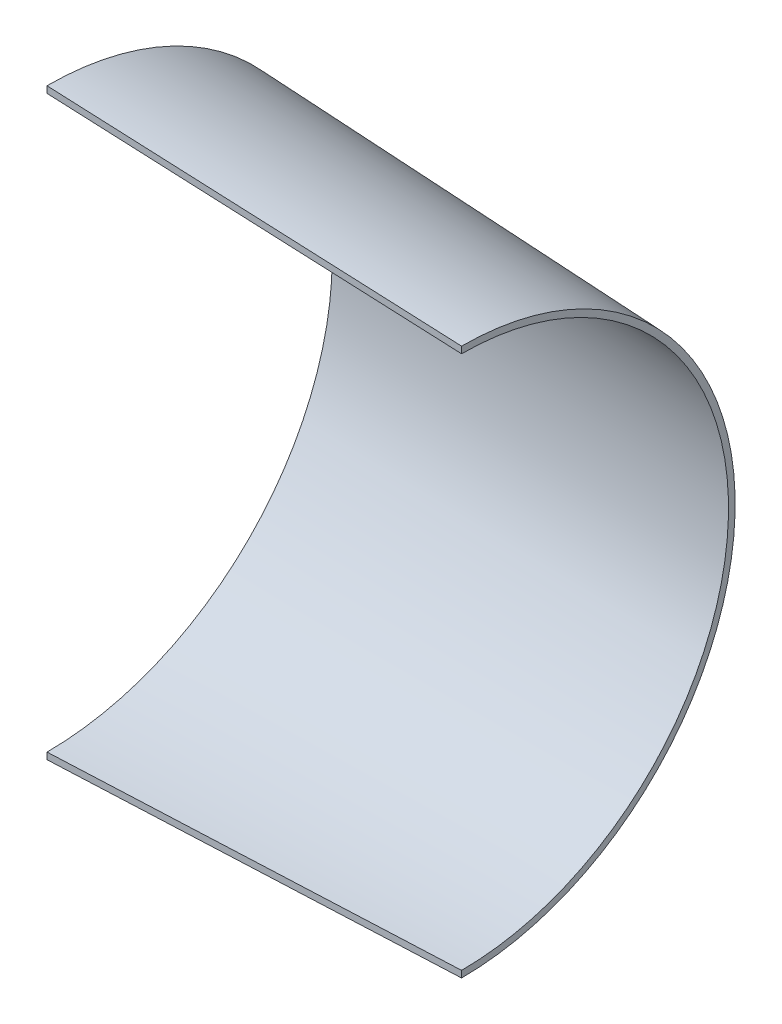
from build123d import *

# Parameters (mm, degrees)
REVOLVE1_ANGLE = 179.99999693


with BuildPart() as part:
    # Sketch1 → Revolve1 (revolve)
    with BuildSketch(Plane.XY):
        Polygon((700, -1720), (700, -1760), (3200, -1650), (3200, -1610), align=None)
    revolve(axis=Axis((0, 0, 0), (1, 0, 0)), revolution_arc=REVOLVE1_ANGLE)


solid = part.part
